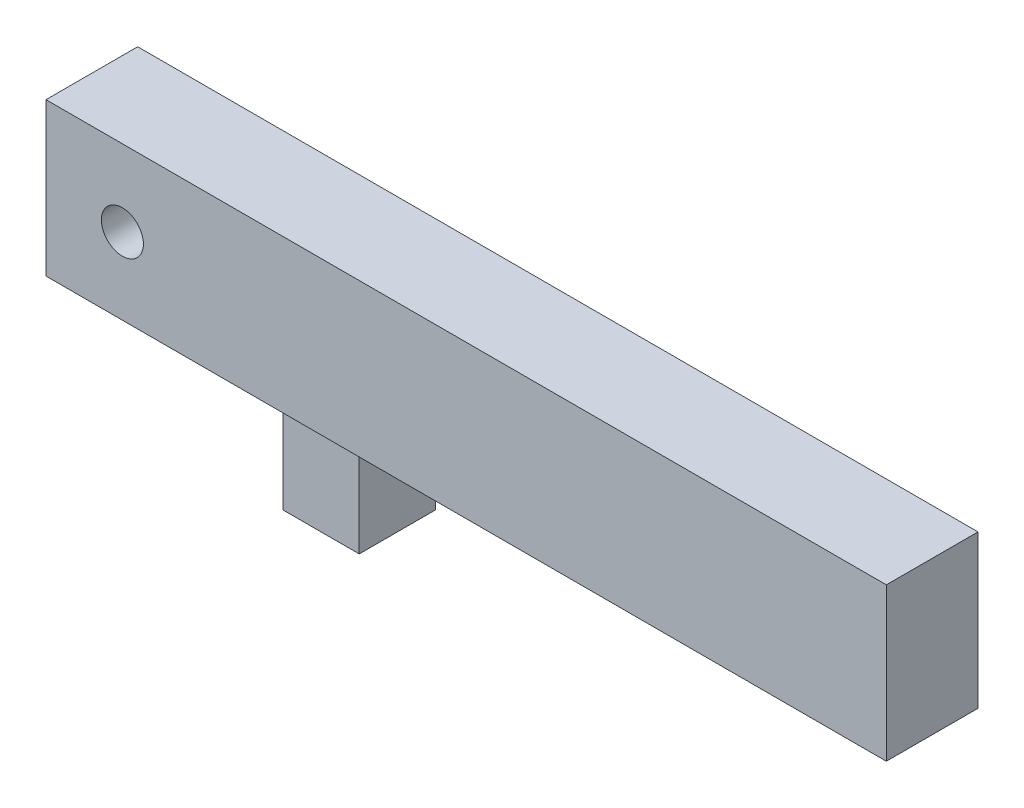
from build123d import *

# Parameters (mm, degrees)
SKETCH1_W               = 110
SKETCH1_H               = 20
BOSS_EXTRUDE1_DEPTH     = 12
CUT_EXTRUDE1_DEPTH      = 113.445542375
CUT_EXTRUDE1_DEPTH_BACK = 113.445542375
SKETCH2_R               = 2.75
SKETCH3_W               = 10
SKETCH3_H               = 10
BOSS_EXTRUDE2_DEPTH     = 12


with BuildPart() as part:
    # Sketch1 → Boss-Extrude1 (new body)
    with BuildSketch(Plane.XY):
        with Locations((55, 10)):
            Rectangle(SKETCH1_W, SKETCH1_H)
    extrude(amount=BOSS_EXTRUDE1_DEPTH)

    # Sketch2 → Cut-Extrude1 (cut, two sides: drawn at the far end of the back side and taken through both)
    with BuildSketch(Plane.XY.offset(12).offset(-CUT_EXTRUDE1_DEPTH_BACK)):
        with Locations((10, 10)):
            Circle(SKETCH2_R)
    extrude(amount=CUT_EXTRUDE1_DEPTH + CUT_EXTRUDE1_DEPTH_BACK, mode=Mode.SUBTRACT)

    # Sketch3 → Boss-Extrude2 (add)
    with BuildSketch(Plane.XZ):
        with Locations((35, 6)):
            Rectangle(SKETCH3_W, SKETCH3_H)
    extrude(amount=BOSS_EXTRUDE2_DEPTH)


solid = part.part
